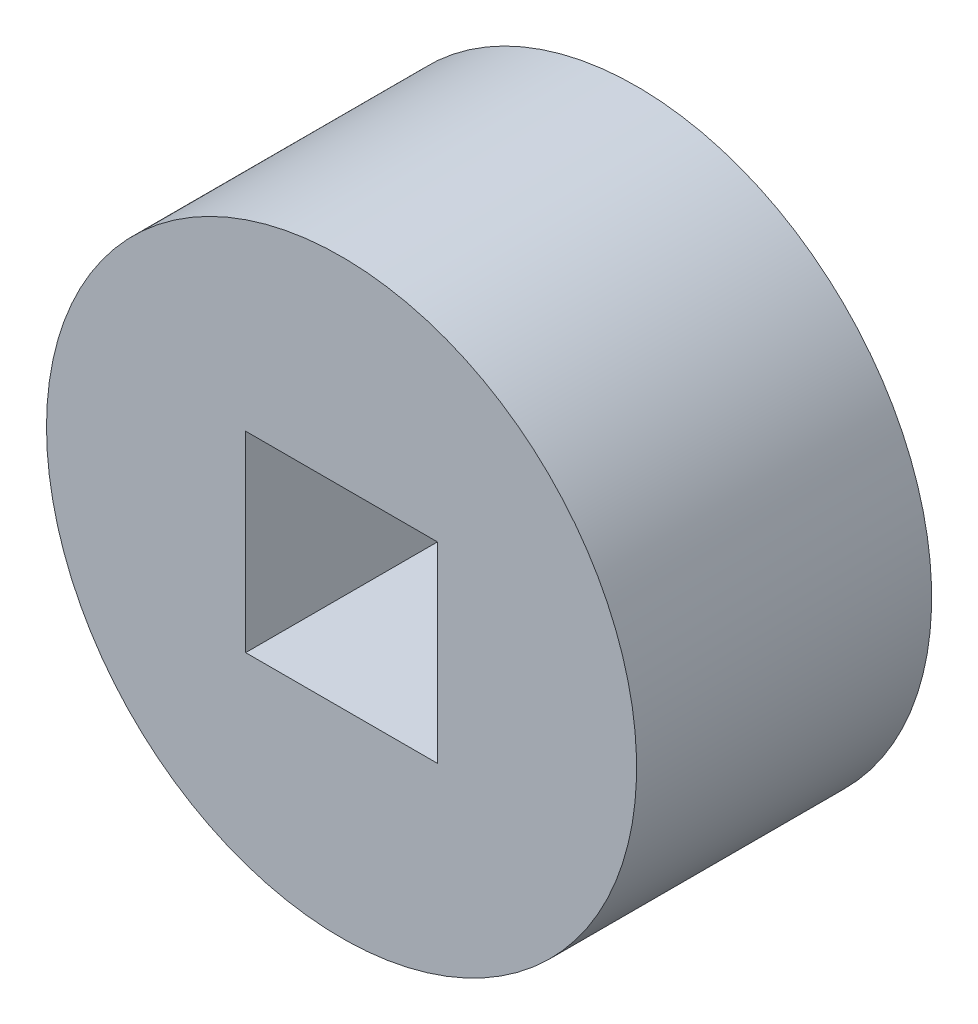
from build123d import *

# Parameters (mm, degrees)
ESQUISSE1_W             = 8
ESQUISSE1_H             = 8
ESQUISSE3_W             = 5.2
ESQUISSE3_H             = 5.2
ENL_V_MAT_EXTRU_1_DEPTH = 5.5


with BuildPart() as part:
    # Esquisse1 → Révolution2 (revolve)
    with BuildSketch(Plane(origin=(0, 0, 0), x_dir=(1, 0, 0), z_dir=(0, 1, 0)), mode=Mode.PRIVATE) as r_volution2_sk:
        with Locations((4, 4)):
            Rectangle(ESQUISSE1_W, ESQUISSE1_H)
    revolve(r_volution2_sk.sketch.rotate(Axis((0, 0, -8), (0, 0, 1)), 180), axis=Axis((0, 0, -8), (0, 0, 1)))

    # Esquisse3 → Enlèv. mat.-Extru.1 (cut)
    with BuildSketch(Plane.XY):
        Rectangle(ESQUISSE3_W, ESQUISSE3_H)
    extrude(amount=-ENL_V_MAT_EXTRU_1_DEPTH, mode=Mode.SUBTRACT)


solid = part.part
